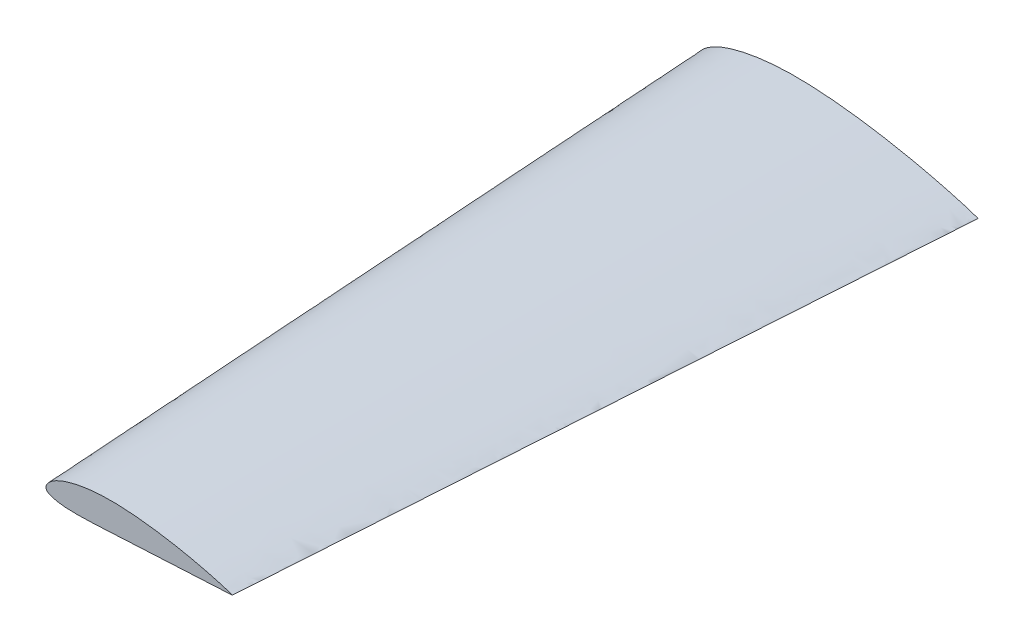
from build123d import *


with BuildPart() as part:
    # Sketch2 → Loft1 section 0
    with BuildSketch(Plane.XY):
        with BuildLine():
            add(Edge.make_bspline(
                [(120, 0), (120.022384754, 0.088858213), (117.529465416, 0.76655728), (115.645469186, 1.559492433), (111.602726822, 2.702099645), (107.366243064, 3.886202623), (102.188969756, 5.216296208), (96.332565014, 6.606702758), (89.84301129, 8.028226141), (82.84629699, 9.405154025), (75.456199258, 10.675450627), (67.801234327, 11.783103119), (60.012638801, 12.686235785), (52.223162104, 13.339442692), (44.563168168, 13.675772086), (37.162427273, 13.628237267), (30.150182347, 13.170715138), (23.647556567, 12.330057836), (17.764709039, 11.15273642), (12.596343196, 9.710721519), (8.211556477, 8.040863566), (4.746468764, 6.133120505), (2.127368016, 4.207581845), (0.501441136, 2.228645415), (-0.226685793, 0.241421862), (0.841050579, -2.431174626), (5.019222974, -3.705935019), (10.641713606, -4.820296002), (18.137871944, -5.073174875), (27.089671483, -4.935920443), (37.336556909, -4.425106456), (48.444278472, -3.871849088), (60.002367664, -3.267660116), (71.554494203, -2.59159443), (82.670666966, -1.919103328), (92.88837754, -1.372527667), (101.934288393, -0.959485986), (109.108419165, -0.600785276), (115.043774382, -0.459723921), (117.582591266, -0.121761562), (119.978863565, -0.083902904), (120, 0)],
                knots=[0, 0, 0, 0, 0.004955764, 0.019500528, 0.034133928, 0.052404954, 0.073994331, 0.098493153, 0.125474601, 0.154451971, 0.1849093, 0.216326677, 0.248168986, 0.27990873, 0.311030457, 0.341049812, 0.369546228, 0.396130575, 0.420447045, 0.44217964, 0.461102572, 0.477136472, 0.490041484, 0.500147948, 0.508077763, 0.514148335, 0.532731192, 0.555552546, 0.585739498, 0.622463907, 0.664407468, 0.709926081, 0.757276033, 0.804638845, 0.850179123, 0.892141925, 0.928905522, 0.959074073, 0.981494736, 0.995320602, 1, 1, 1, 1], degree=3))
        make_face()
    # Sketch3 → Loft1 section 1
    with BuildSketch(Plane.XY.offset(300)):
        with BuildLine():
            add(Edge.make_bspline(
                [(100, 0), (100.014923169, 0.059238809), (98.352976944, 0.511038187), (97.096979457, 1.039661622), (94.401817881, 1.801399763), (91.577495376, 2.590801749), (88.125979837, 3.477530805), (84.22171001, 4.404468505), (79.89534086, 5.35215076), (75.23086466, 6.270102683), (70.304132839, 7.116967084), (65.200822885, 7.855402079), (60.008425868, 8.457490523), (54.815441403, 8.892961794), (49.708778779, 9.117181391), (44.774951515, 9.085491511), (40.100121565, 8.780476759), (35.765037711, 8.220038557), (31.843139359, 7.435157613), (28.397562131, 6.473814346), (25.474370985, 5.360575711), (23.164312509, 4.088747004), (21.418245344, 2.805054563), (20.334294091, 1.48576361), (19.848876138, 0.160947908), (20.560700386, -1.620783084), (23.34614865, -2.470623346), (27.094475737, -3.213530668), (32.091914629, -3.382116584), (38.059780988, -3.290613629), (44.891037939, -2.950070971), (52.296185648, -2.581232726), (60.001578443, -2.178440077), (67.702996135, -1.72772962), (75.113777977, -1.279402219), (81.925585027, -0.915018444), (87.956192262, -0.639657324), (92.73894611, -0.400523517), (96.695849588, -0.306482614), (98.388394177, -0.081174375), (99.985909043, -0.055935269), (100, 0)],
                knots=[0, 0, 0, 0, 0.004955764, 0.019500528, 0.034133928, 0.052404954, 0.073994331, 0.098493153, 0.125474601, 0.154451971, 0.1849093, 0.216326677, 0.248168986, 0.27990873, 0.311030457, 0.341049812, 0.369546228, 0.396130575, 0.420447045, 0.44217964, 0.461102572, 0.477136472, 0.490041484, 0.500147948, 0.508077763, 0.514148335, 0.532731192, 0.555552546, 0.585739498, 0.622463907, 0.664407468, 0.709926081, 0.757276033, 0.804638845, 0.850179123, 0.892141925, 0.928905522, 0.959074073, 0.981494736, 0.995320602, 1, 1, 1, 1], degree=3))
        make_face()
    loft()


solid = part.part
